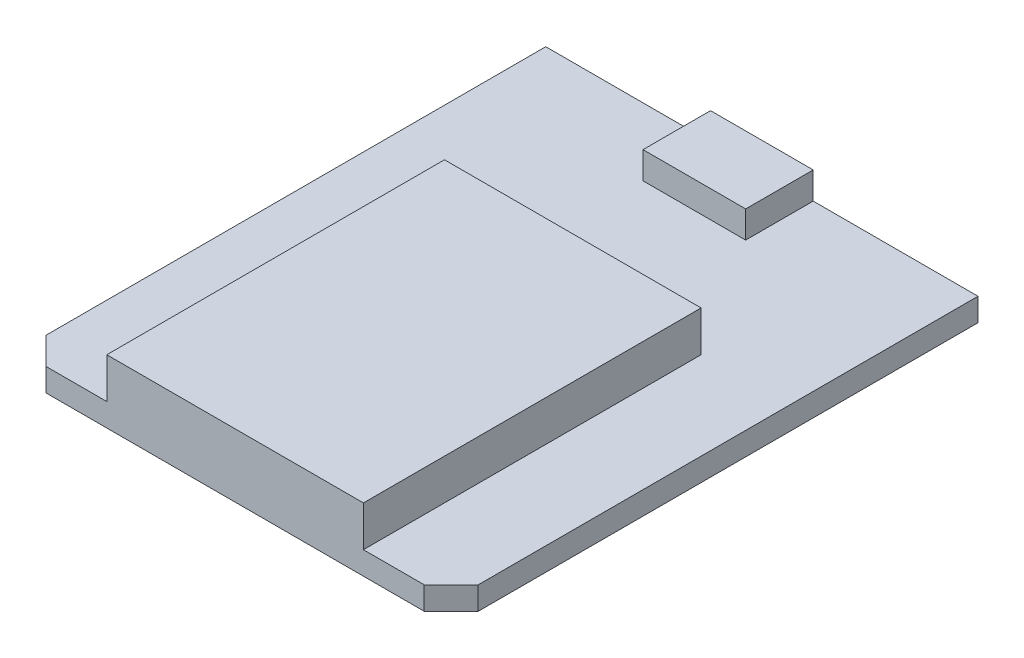
from build123d import *

# Parameters (mm, degrees)
SKETCH1_W           = 32
SKETCH1_H           = 39
BOSS_EXTRUDE1_DEPTH = 1.7
CHAMFER1_SIZE       = 2
SKETCH3_W           = 19
SKETCH3_H           = 25
BOSS_EXTRUDE2_DEPTH = 3
SKETCH4_W           = 7.6
SKETCH4_H           = 5
BOSS_EXTRUDE3_DEPTH = 2


with BuildPart() as part:
    # Sketch1 → Boss-Extrude1 (new body)
    with BuildSketch(Plane(origin=(0, 0, 0), x_dir=(1, 0, 0), z_dir=(0, 1, 0))):
        with Locations((16, 19.5)):
            Rectangle(SKETCH1_W, SKETCH1_H)
    extrude(amount=BOSS_EXTRUDE1_DEPTH)

    # Chamfer1
    chamfer1_edges = [part.edges().sort_by_distance(p)[0] for p in [
        (32, 0.85, 0),
        (0, 0.85, 0),
    ]]
    chamfer(chamfer1_edges, length=CHAMFER1_SIZE)

    # Sketch3 → Boss-Extrude2 (add)
    with BuildSketch(Plane(origin=(0, 1.7, 0), x_dir=(1, 0, 0), z_dir=(0, 1, 0))):
        with Locations((16, 12.5)):
            Rectangle(SKETCH3_W, SKETCH3_H)
    extrude(amount=BOSS_EXTRUDE2_DEPTH)

    # Sketch4 → Boss-Extrude3 (add)
    with BuildSketch(Plane(origin=(0, 1.7, 0), x_dir=(1, 0, 0), z_dir=(0, 1, 0))):
        with Locations((16, 36.5)):
            Rectangle(SKETCH4_W, SKETCH4_H)
    extrude(amount=BOSS_EXTRUDE3_DEPTH)


solid = part.part
